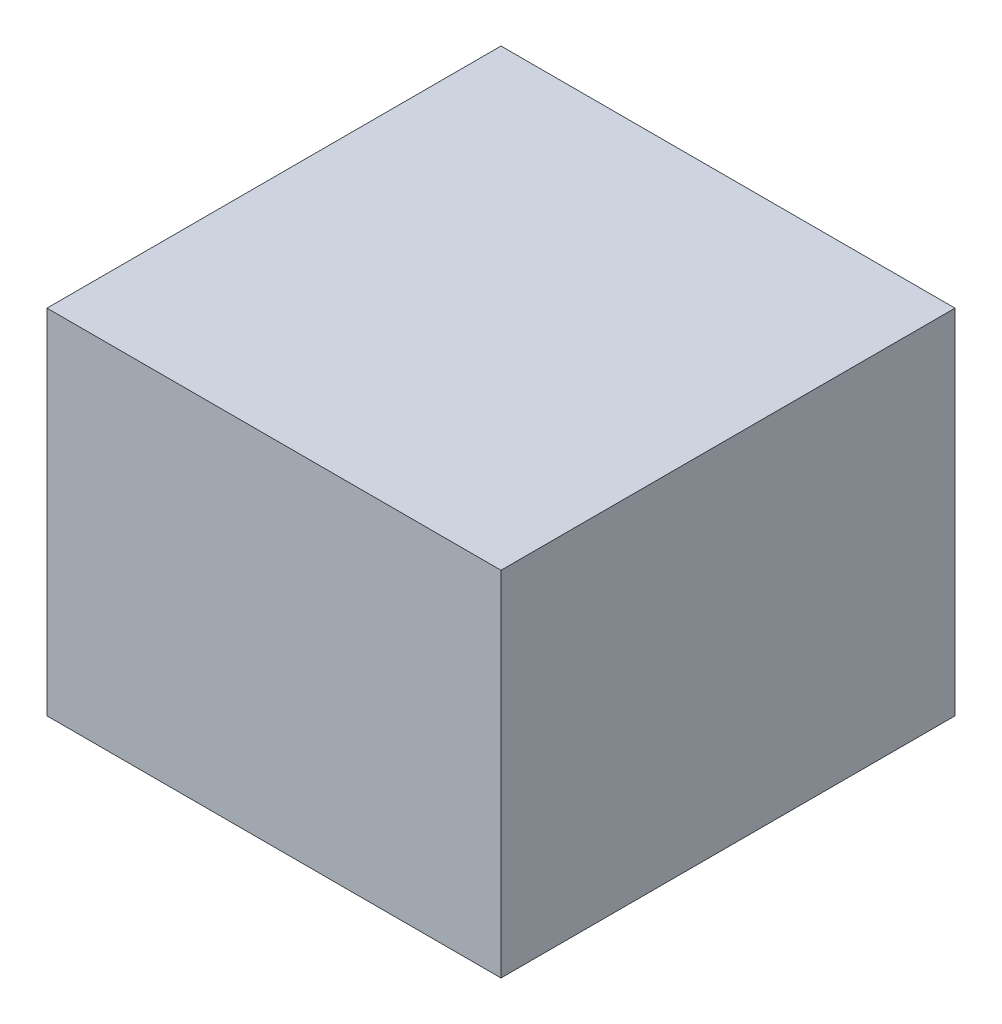
from build123d import *

# Parameters (mm, degrees)
SKETCH1_W           = 57.15
SKETCH1_H           = 57.15
BOSS_EXTRUDE1_DEPTH = 44.45


with BuildPart() as part:
    # Sketch1 → Boss-Extrude1 (new body)
    with BuildSketch(Plane(origin=(0, 0, 0), x_dir=(1, 0, 0), z_dir=(0, 1, 0))):
        with Locations((28.575, 28.575)):
            Rectangle(SKETCH1_W, SKETCH1_H)
    extrude(amount=BOSS_EXTRUDE1_DEPTH)


solid = part.part
